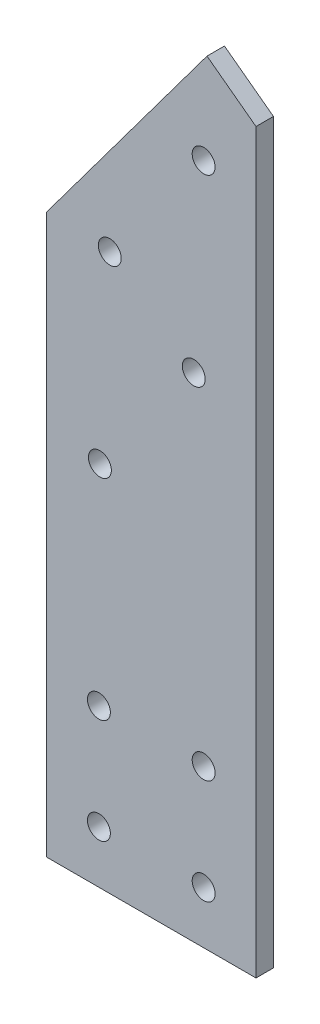
from build123d import *

# Parameters (mm, degrees)
BOSS_EXTRUDE1_DEPTH              = 6.35
F_21_64_0_32813_DIAMETER_HOLE1_D = 8.334502
LPATTERN1_COUNT                  = 2
LPATTERN1_PITCH                  = 38.1
LPATTERN1_COUNT_DIR2             = 2
LPATTERN1_PITCH_DIR2             = 38.1
F_21_64_0_32813_DIAMETER_HOLE2_D = 8.334502
LPATTERN2_COUNT                  = 3
LPATTERN2_PITCH                  = 57.15
LPATTERN2_COUNT_DIR2             = 2
LPATTERN2_PITCH_DIR2             = 38.1


with BuildPart() as part:
    # Sketch2 → Boss-Extrude1 (new body)
    with BuildSketch(Plane.XY):
        Polygon((0, 0), (76.2, 0), (76.2, 268.269814476), (58.378218394, 281.548923082), (0, 203.2), align=None)
    extrude(amount=BOSS_EXTRUDE1_DEPTH)

    # 21/64 (0.32813) Diameter Hole1 (through all)
    with Locations(Plane.XY.offset(6.35)):
        with Locations((57.15, 19.05)):
            f_21_64_0_32813_diameter_hole1 = Hole(F_21_64_0_32813_DIAMETER_HOLE1_D / 2)

    # LPattern1: 21_64 _0.32813_ Diameter Hole1 2 × 2
    with Locations(*[(-i * LPATTERN1_PITCH, j * LPATTERN1_PITCH_DIR2, 0) for i in range(LPATTERN1_COUNT) for j in range(LPATTERN1_COUNT_DIR2) if (i, j) != (0, 0)]):
        add(f_21_64_0_32813_diameter_hole1, mode=Mode.SUBTRACT)

    # 21/64 (0.32813) Diameter Hole2 (through all)
    with Locations(Plane.XY.offset(6.35)):
        with Locations((57.15, 248.0169065)):
            f_21_64_0_32813_diameter_hole2 = Hole(F_21_64_0_32813_DIAMETER_HOLE2_D / 2)

    # LPattern2: 21_64 _0.32813_ Diameter Hole2 3 × 2, 2 skipped
    with Locations(*[Vector(-0.5974852016253348, -0.8018799372965589, 0) * (i * LPATTERN2_PITCH) + Vector(0.8018799372965594, -0.5974852016253339, 0) * (j * LPATTERN2_PITCH_DIR2) for i in range(LPATTERN2_COUNT) for j in range(LPATTERN2_COUNT_DIR2) if (i, j) not in ((0, 0), (0, 1), (2, 0))]):
        add(f_21_64_0_32813_diameter_hole2, mode=Mode.SUBTRACT)


solid = part.part
